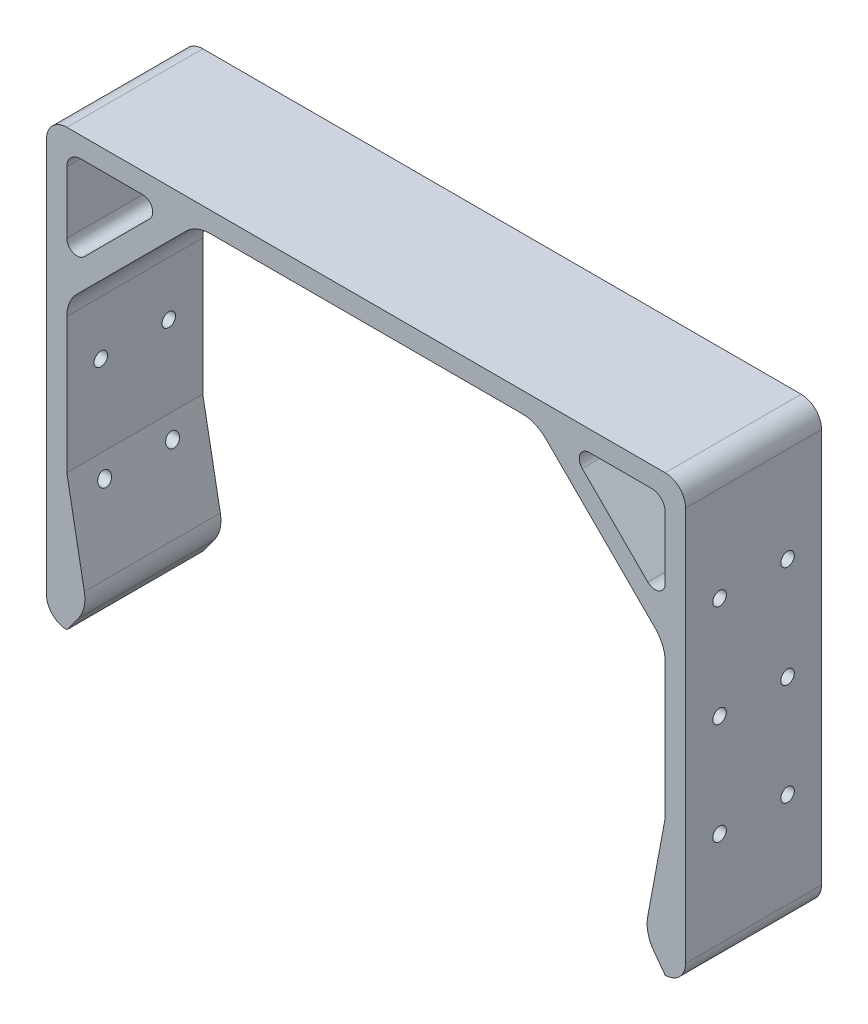
from build123d import *

# Parameters (mm, degrees)
BOSS_EXTRUDE2_DEPTH = 20
SKETCH2_R           = 1
CUT_EXTRUDE1_DEPTH  = 5


with BuildPart() as part:
    # Sketch1 → Boss-Extrude2 (new body)
    with BuildSketch(Plane.XY):
        with BuildLine():
            ThreePointArc((-47, -29), (-46.121320344, -31.121320344), (-44, -32))
            Line((-44, -32), (-42.320425457, -29.72852746))
            ThreePointArc((-42.320425457, -29.72852746), (-41.468325666, -27.878092848), (-41.42508346, -25.841352212))
            Line((-41.42508346, -25.841352212), (-44, -12))
            Line((-44, -12), (-44, 7.928932188))
            ThreePointArc((-44, 7.928932188), (-43.619397663, 9.84234935), (-42.535533906, 11.464466094))
            Line((-42.535533906, 11.464466094), (-26.464466094, 27.535533906))
            ThreePointArc((-26.464466094, 27.535533906), (-24.84234935, 28.619397663), (-22.928932188, 29))
            Line((-22.928932188, 29), (22.928932188, 29))
            ThreePointArc((22.928932188, 29), (24.84234935, 28.619397663), (26.464466094, 27.535533906))
            Line((26.464466094, 27.535533906), (42.535533906, 11.464466094))
            ThreePointArc((42.535533906, 11.464466094), (43.619397663, 9.84234935), (44, 7.928932188))
            Line((44, 7.928932188), (44, -12))
            Line((44, -12), (41.42508346, -25.841352212))
            ThreePointArc((41.42508346, -25.841352212), (41.468325666, -27.878092848), (42.320425457, -29.72852746))
            Line((42.320425457, -29.72852746), (44, -32))
            ThreePointArc((44, -32), (46.121320344, -31.121320344), (47, -29))
            Line((47, -29), (47, 29))
            ThreePointArc((47, 29), (46.121320344, 31.121320344), (44, 32))
            Line((44, 32), (-44, 32))
            ThreePointArc((-44, 32), (-46.121320344, 31.121320344), (-47, 29))
            Line((-47, 29), (-47, -29))
        make_face()
        with BuildLine():
            ThreePointArc((-44, 27), (-43.414213562, 28.414213562), (-42, 29))
            Line((-42, 29), (-32.863961031, 29))
            ThreePointArc((-32.863961031, 29), (-31.478141732, 28.074025149), (-31.803300859, 26.439339828))
            Line((-31.803300859, 26.439339828), (-41.439339828, 16.803300859))
            ThreePointArc((-41.439339828, 16.803300859), (-43.074025149, 16.478141732), (-44, 17.863961031))
            Line((-44, 17.863961031), (-44, 27))
        make_face(mode=Mode.SUBTRACT)
        with BuildLine():
            ThreePointArc((42, 29), (43.414213562, 28.414213562), (44, 27))
            Line((44, 27), (44, 17.863961031))
            ThreePointArc((44, 17.863961031), (43.074025149, 16.478141732), (41.439339828, 16.803300859))
            Line((41.439339828, 16.803300859), (31.803300859, 26.439339828))
            ThreePointArc((31.803300859, 26.439339828), (31.478141732, 28.074025149), (32.863961031, 29))
            Line((32.863961031, 29), (42, 29))
        make_face(mode=Mode.SUBTRACT)
    extrude(amount=BOSS_EXTRUDE2_DEPTH)

    # Sketch2 → Cut-Extrude1 (cut)
    with BuildSketch(Plane.ZY.offset(47)):
        with Locations((5, 15)):
            Circle(SKETCH2_R)
        with Locations((15, 15)):
            Circle(SKETCH2_R)
        with Locations((15, 0)):
            Circle(SKETCH2_R)
        with Locations((15, -15)):
            Circle(SKETCH2_R)
        with Locations((5, 0)):
            Circle(SKETCH2_R)
        with Locations((5, -15)):
            Circle(SKETCH2_R)
    cut_extrude1 = extrude(amount=-CUT_EXTRUDE1_DEPTH, mode=Mode.SUBTRACT)

    # Mirror1: Cut-Extrude1 across plane
    add(cut_extrude1.mirror(Plane(origin=(0, 0, 0), x_dir=(0, 0, 1), z_dir=(1, 0, 0))), mode=Mode.SUBTRACT)


solid = part.part
